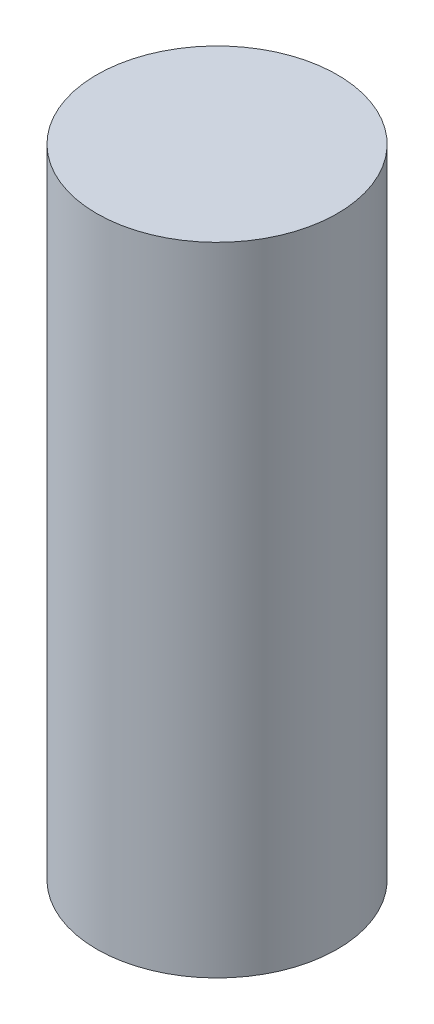
from build123d import *

# Parameters (mm, degrees)
IZIM1_R                     = 3
Y_KSEKLIK_EKSTR_ZYON1_DEPTH = 15.89


with BuildPart() as part:
    # Çizim1 → Yükseklik-Ekstrüzyon1 (new body)
    with BuildSketch(Plane(origin=(0, 0, 0), x_dir=(1, 0, 0), z_dir=(0, 1, 0))):
        with Locations(Location((0, 0, 0), (0, 0, 270))):
            Circle(IZIM1_R)
    extrude(amount=Y_KSEKLIK_EKSTR_ZYON1_DEPTH)


solid = part.part
